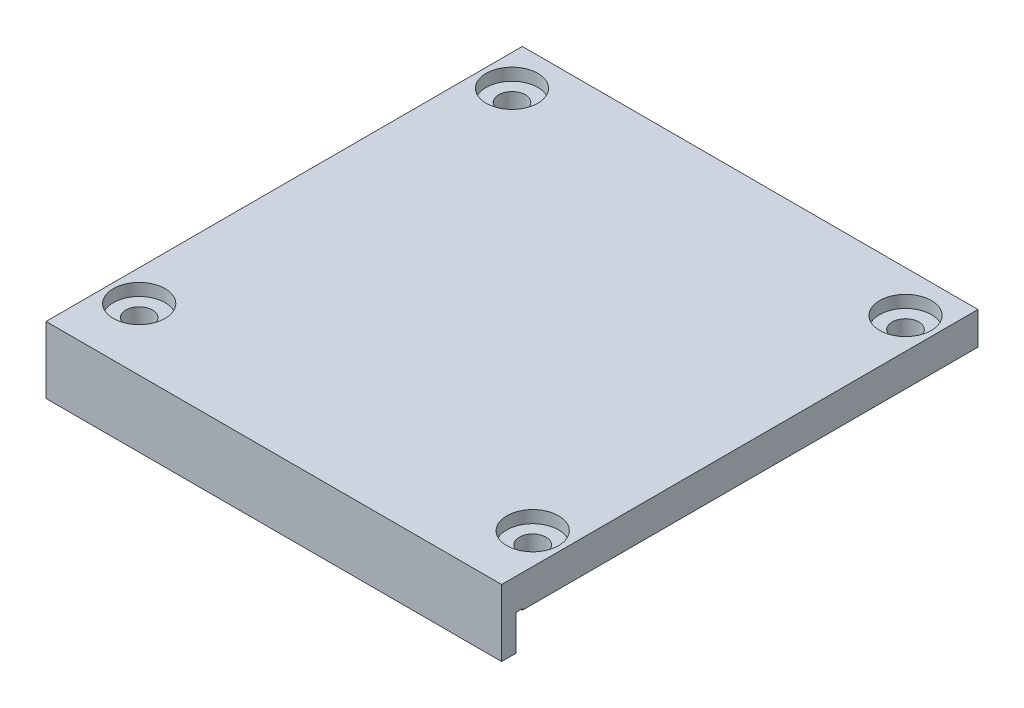
from build123d import *

# Parameters (mm, degrees)
SKETCH1_W                                      = 55.88
SKETCH1_H                                      = 55.88
BOSS_EXTRUDE1_DEPTH                            = 4
CBORE_FOR_4_BUTTON_HEAD_CAP_SCREW1_D           = 3.2639
CBORE_FOR_4_BUTTON_HEAD_CAP_SCREW1_CBORE_D     = 6.35
CBORE_FOR_4_BUTTON_HEAD_CAP_SCREW1_CBORE_DEPTH = 1.4986
SKETCH4_W                                      = 55.88
SKETCH4_H                                      = 8.184570626
BOSS_EXTRUDE2_DEPTH                            = 2.54
SKETCH5_W                                      = 55.88
SKETCH5_H                                      = 4.348891515
CUT_EXTRUDE1_DEPTH                             = 0.762


with BuildPart() as part:
    # Sketch1 → Boss-Extrude1 (new body)
    with BuildSketch(Plane(origin=(0, 0, 0), x_dir=(1, 0, 0), z_dir=(0, 1, 0))):
        Rectangle(SKETCH1_W, SKETCH1_H)
    extrude(amount=BOSS_EXTRUDE1_DEPTH)

    # CBORE for #4 Button Head Cap Screw1 (through all)
    with Locations(Plane(origin=(0, 4, 0), x_dir=(1, 0, 0), z_dir=(0, 1, 0))):
        with Locations((-24.13, 22.86), (24.13, 22.86), (24.13, -22.86), (-24.13, -22.86)):
            CounterBoreHole(CBORE_FOR_4_BUTTON_HEAD_CAP_SCREW1_D / 2, CBORE_FOR_4_BUTTON_HEAD_CAP_SCREW1_CBORE_D / 2, CBORE_FOR_4_BUTTON_HEAD_CAP_SCREW1_CBORE_DEPTH)

    # Sketch4 → Boss-Extrude2 (add)
    with BuildSketch(Plane.XY.offset(27.94)):
        with Locations((0, -0.092285313)):
            Rectangle(SKETCH4_W, SKETCH4_H)
    extrude(amount=BOSS_EXTRUDE2_DEPTH)

    # Sketch5 → Cut-Extrude1 (cut)
    with BuildSketch(Plane(origin=(0, 0, 27.94), x_dir=(-1, 0, 0), z_dir=(0, 0, -1))):
        with Locations((0, -2.010124869)):
            Rectangle(SKETCH5_W, SKETCH5_H)
    extrude(amount=-CUT_EXTRUDE1_DEPTH, mode=Mode.SUBTRACT)


solid = part.part
